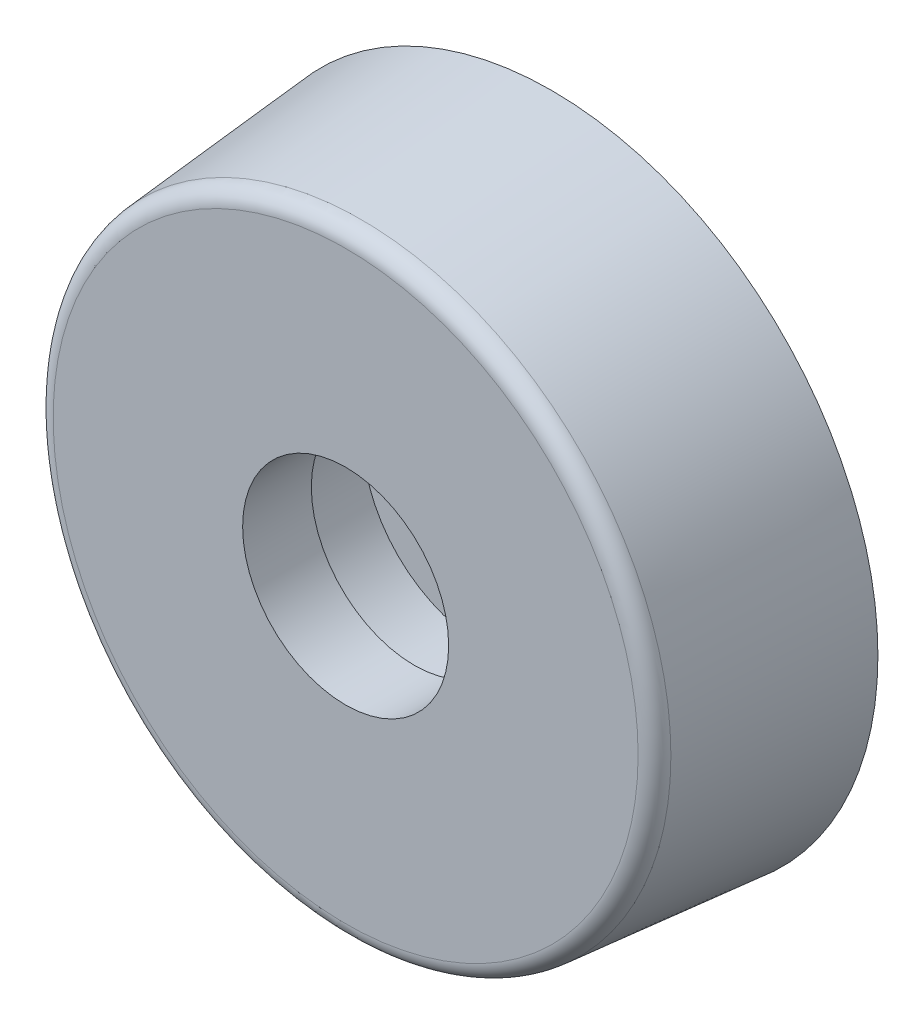
from build123d import *

# Parameters (mm, degrees)
SKETCH_1_R          = 9.5
EXTRUDE_1_DEPTH     = 6
EXTRUDE_1_TAPER     = 5
SKETCH_2_R          = 8
SKETCH_2_R_2        = 4.5
CUT_EXTRUDE_2_DEPTH = 3
SKETCH_3_R          = 3.5
CUT_EXTRUDE_3_DEPTH = 4
SKETCH_4_R          = 3.55
SKETCH_4_R_2        = 3
EXTRUDE_2_DEPTH     = 2
FILLET_1_R          = 0.5


with BuildPart() as part:
    # Эскиз1 → Бобышка-Вытянуть1 (new body)
    with BuildSketch(Plane.XY):
        Circle(SKETCH_1_R)
    extrude(amount=EXTRUDE_1_DEPTH, taper=EXTRUDE_1_TAPER)

    # Эскиз2 → Вырез-Вытянуть2 (cut)
    with BuildSketch(Plane(origin=(0, 0, 0), x_dir=(-1, 0, 0), z_dir=(0, 0, -1))):
        Circle(SKETCH_2_R)
        Circle(SKETCH_2_R_2, mode=Mode.SUBTRACT)
    extrude(amount=-CUT_EXTRUDE_2_DEPTH, mode=Mode.SUBTRACT)

    # Эскиз3 → Вырез-Вытянуть3 (cut)
    with BuildSketch(Plane.XY.offset(6)):
        Circle(SKETCH_3_R)
    extrude(amount=-CUT_EXTRUDE_3_DEPTH, mode=Mode.SUBTRACT)

    # Эскиз4 → Бобышка-Вытянуть2 (add)
    with BuildSketch(Plane.XY.offset(6)):
        Circle(SKETCH_4_R)
        Circle(SKETCH_4_R_2, mode=Mode.SUBTRACT)
    extrude(amount=-EXTRUDE_2_DEPTH)

    # Скругление1
    fillet_1_edges = [part.edges().sort_by_distance(p)[0] for p in [
        (-8.975068019, 0, 6),
    ]]
    fillet(fillet_1_edges, radius=FILLET_1_R)


solid = part.part
